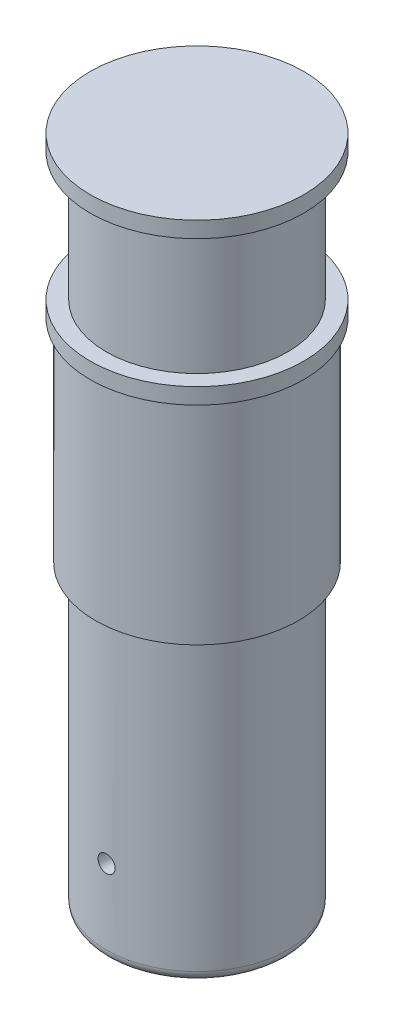
from build123d import *

# Parameters (mm, degrees)
FILLET1_R = 1
SKETCH3_W = 0.8
SKETCH3_H = 8.5


with BuildPart() as part:
    # Sketch1 → Revolve1 (revolve)
    with BuildSketch(Plane.XY):
        Polygon((-8.5, -48), (-8.5, -19.8), (-9.5, -19.8), (-9.5, 0), (-10, 0), (-10, 1.5), (-8.5, 1.5), (-8.5, 13.5), (-10, 13.5), (-10, 15), (0, 15), (0, -34), (-4, -34), (-4, -48), align=None)
    revolve(axis=Axis((0, 15, 0), (0, -1, 0)))

    # Fillet1
    fillet1_edges = [part.edges().sort_by_distance(p)[0] for p in [
        (8.5, -48, 0),
        (4, -48, 0),
    ]]
    fillet(fillet1_edges, radius=FILLET1_R)

    # Sketch3 → M2x0.4 Tapped Hole1 (revolve, cut)
    with BuildSketch(Plane(origin=(0, -40, 0), x_dir=(0, 1, 0), z_dir=(1, 0, 0))):
        with Locations((0.4, 4.25)):
            Rectangle(SKETCH3_W, SKETCH3_H)
    revolve(axis=Axis((0, -40, -6.35), (0, 0, 1)), mode=Mode.SUBTRACT)


solid = part.part
